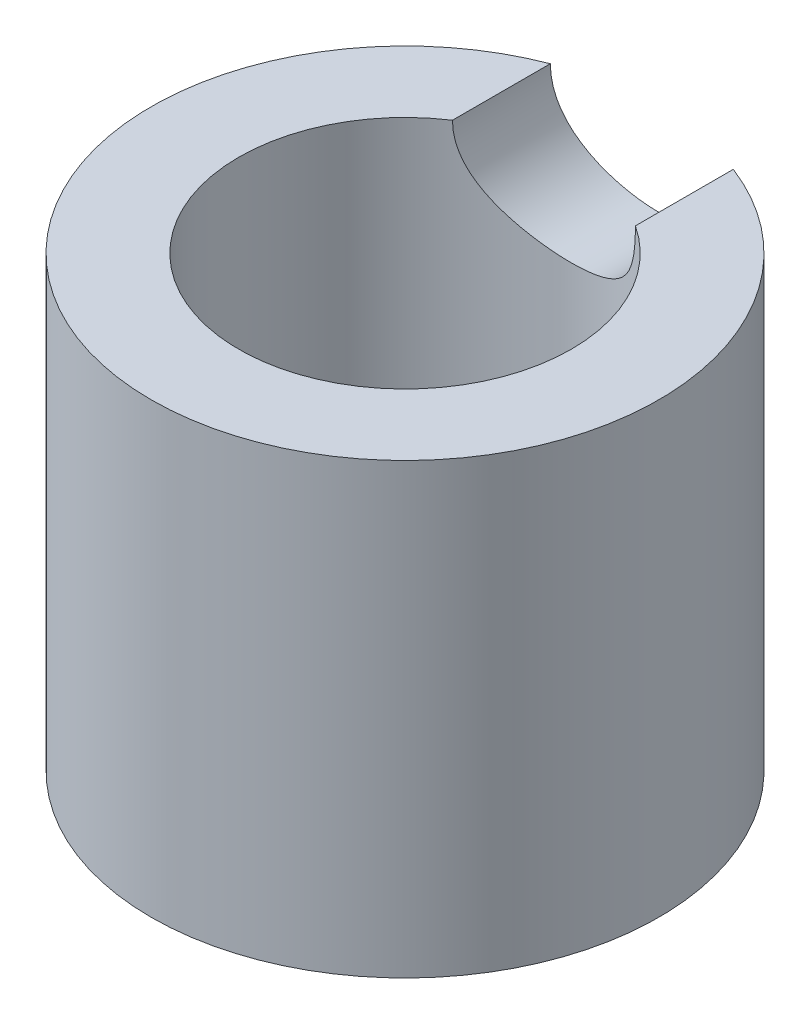
from build123d import *

# Parameters (mm, degrees)
SKETCH1_R           = 29
SKETCH1_R_2         = 19
BOSS_EXTRUDE1_DEPTH = 51.2
SKETCH2_R           = 10.45
CUT_EXTRUDE1_DEPTH  = 66.600609753


with BuildPart() as part:
    # Sketch1 → Boss-Extrude1 (new body)
    with BuildSketch(Plane(origin=(0, 0, 0), x_dir=(1, 0, 0), z_dir=(0, 1, 0))):
        with Locations(Location((0, 0, 0), (0, 0, 270))):
            Circle(SKETCH1_R)
        with Locations(Location((0, 0, 0), (0, 0, 270))):
            Circle(SKETCH1_R_2, mode=Mode.SUBTRACT)
    extrude(amount=BOSS_EXTRUDE1_DEPTH)

    # Sketch2 → Cut-Extrude1 (cut, through all)
    with BuildSketch(Plane.XY):
        with Locations((0, 51.2)):
            Circle(SKETCH2_R)
        Circle(SKETCH2_R)
    extrude(amount=-CUT_EXTRUDE1_DEPTH, mode=Mode.SUBTRACT)


solid = part.part
